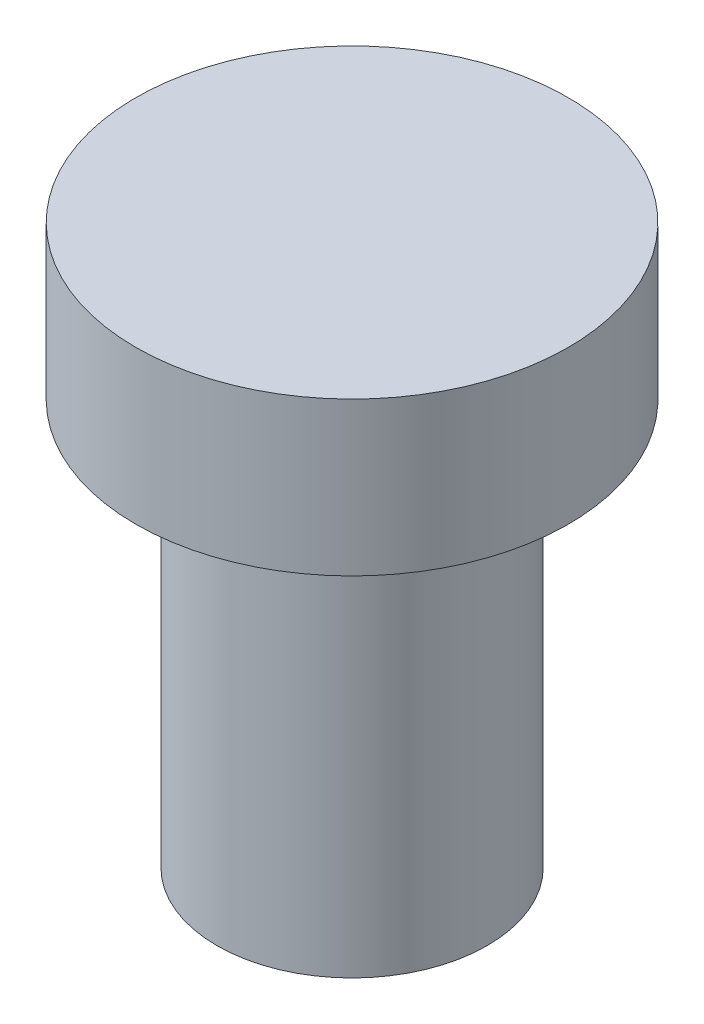
from build123d import *

# Parameters (mm, degrees)
ESQUISSE1_R        = 2.4
BOSS_EXTRU_1_DEPTH = 1.7
ESQUISSE2_R        = 1.5
BOSS_EXTRU_2_DEPTH = 4.5


with BuildPart() as part:
    # Esquisse1 → Boss.-Extru.1 (new body)
    with BuildSketch(Plane(origin=(0, 0, 0), x_dir=(1, 0, 0), z_dir=(0, 1, 0))):
        with Locations(Location((0, 0, 0), (0, 0, 270))):
            Circle(ESQUISSE1_R)
    extrude(amount=BOSS_EXTRU_1_DEPTH)

    # Esquisse2 → Boss.-Extru.2 (add)
    with BuildSketch(Plane.XZ):
        with Locations(Location((0, 0, 0), (0, 0, 270))):
            Circle(ESQUISSE2_R)
    extrude(amount=BOSS_EXTRU_2_DEPTH)


solid = part.part
